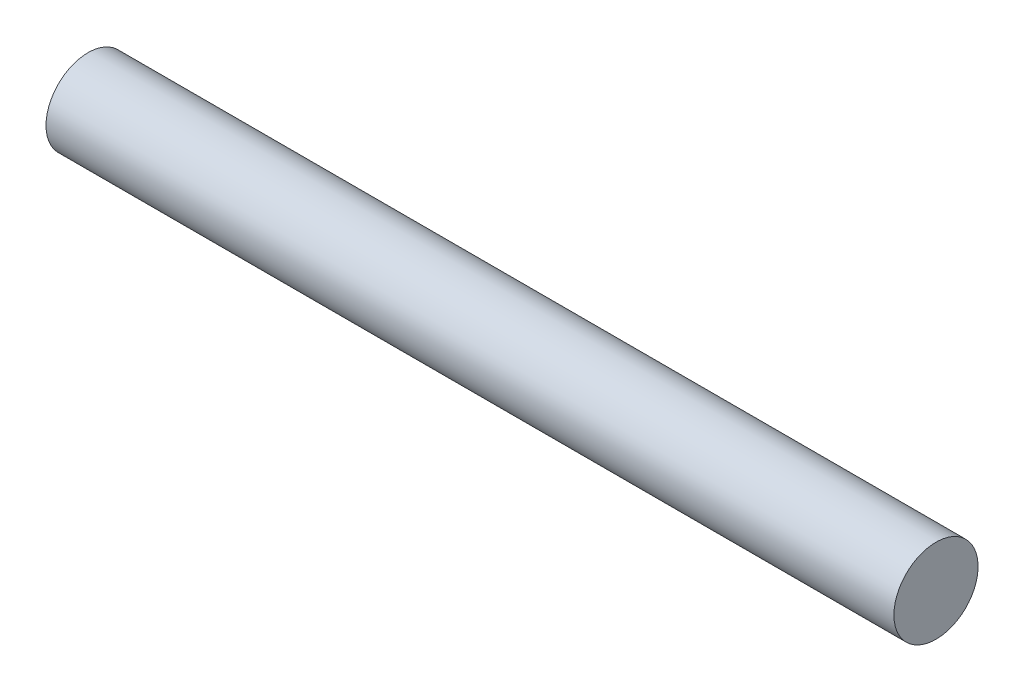
from build123d import *

# Parameters (mm, degrees)
SCHIZZO1_R                   = 2.99
ESTRUSIONE_ESTRUSIONE1_DEPTH = 60.26


with BuildPart() as part:
    # Schizzo1 → Estrusione-Estrusione1 (new body)
    with BuildSketch(Plane(origin=(0, 0, 0), x_dir=(0, 0, -1), z_dir=(1, 0, 0))):
        with Locations(Location((0, 0, 0), (0, 0, 180))):
            Circle(SCHIZZO1_R)
    extrude(amount=ESTRUSIONE_ESTRUSIONE1_DEPTH)


solid = part.part
